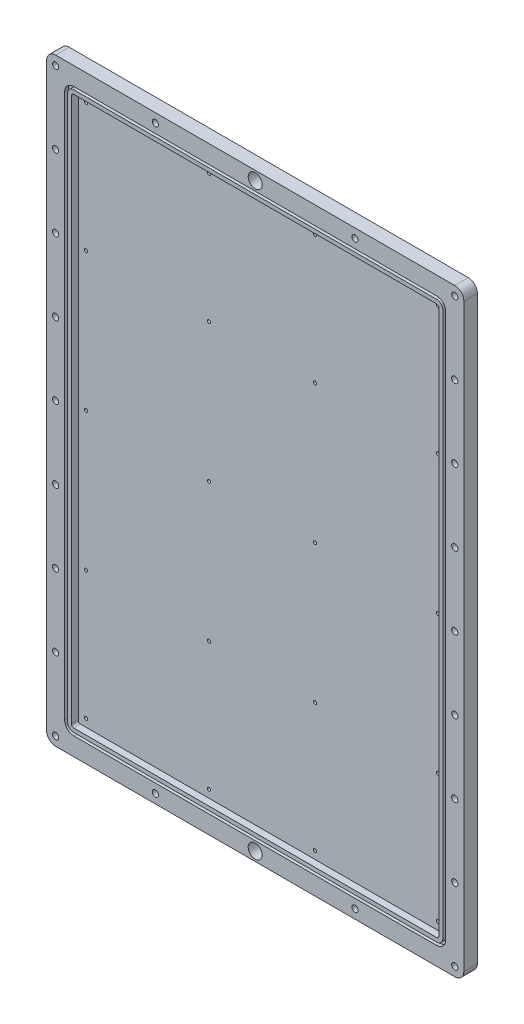
from build123d import *
from OCP.BRepFilletAPI import BRepFilletAPI_MakeChamfer

# Parameters (mm, degrees)
SKETCH1_W           = 292.0492
SKETCH1_H           = 419.0492
BOSS_EXTRUDE1_DEPTH = 9.525
SKETCH4_R           = 2.1844
CUT_EXTRUDE1_DEPTH  = 511.867588389
CUT_EXTRUDE2_DEPTH  = 2.54
LPATTERN3_COUNT     = 4
LPATTERN3_PITCH     = 69.85
LPATTERN4_COUNT     = 8
LPATTERN4_PITCH     = 50.8
CUT_EXTRUDE3_DEPTH  = 4.7625
SKETCH7_R           = 1.1303
CUT_EXTRUDE4_DEPTH  = 3.175
SKETCH8_R           = 4.9022
CUT_EXTRUDE5_DEPTH  = 511.867588389
FILLET1_R           = 6.35
CHAMFER1_SIZE       = 2.8448
CHAMFER1_SIZE2      = 2.472946912


with BuildPart() as part:
    # Sketch1 → Boss-Extrude1 (new body)
    with BuildSketch(Plane.XY):
        with Locations((146.0246, 209.5246)):
            Rectangle(SKETCH1_W, SKETCH1_H)
    extrude(amount=BOSS_EXTRUDE1_DEPTH)

    # Sketch4 → Cut-Extrude1 (cut, through all)
    with BuildSketch(Plane.XY.offset(9.525)):
        with Locations((6.3246, 6.3246)):
            Circle(SKETCH4_R)
        with Locations((6.3246, 412.7246)):
            Circle(SKETCH4_R)
        with Locations((285.7246, 412.7246)):
            Circle(SKETCH4_R)
        with Locations((285.7246, 6.3246)):
            Circle(SKETCH4_R)
    cut_extrude1 = extrude(amount=-CUT_EXTRUDE1_DEPTH, mode=Mode.SUBTRACT)

    # Sketch5 → Cut-Extrude2 (cut)
    with BuildSketch(Plane.XY.offset(9.525)):
        with BuildLine():
            Line((19.0246, 406.3746), (273.0246, 406.3746))
            ThreePointArc((273.0246, 406.3746), (277.514728061, 404.514728061), (279.3746, 400.0246))
            Line((279.3746, 400.0246), (279.3746, 19.0246))
            ThreePointArc((279.3746, 19.0246), (277.514728061, 14.534471939), (273.0246, 12.6746))
            Line((273.0246, 12.6746), (19.0246, 12.6746))
            ThreePointArc((19.0246, 12.6746), (14.534471939, 14.534471939), (12.6746, 19.0246))
            Line((12.6746, 19.0246), (12.6746, 400.0246))
            ThreePointArc((12.6746, 400.0246), (14.534471939, 404.514728061), (19.0246, 406.3746))
        make_face()
        with BuildLine():
            ThreePointArc((273.0246, 14.7066), (276.077887081, 15.971312919), (277.3426, 19.0246))
            Line((277.3426, 19.0246), (277.3426, 400.0246))
            ThreePointArc((277.3426, 400.0246), (276.077887081, 403.077887081), (273.0246, 404.3426))
            Line((273.0246, 404.3426), (19.0246, 404.3426))
            ThreePointArc((19.0246, 404.3426), (15.971312919, 403.077887081), (14.7066, 400.0246))
            Line((14.7066, 400.0246), (14.7066, 19.0246))
            ThreePointArc((14.7066, 19.0246), (15.971312919, 15.971312919), (19.0246, 14.7066))
            Line((19.0246, 14.7066), (273.0246, 14.7066))
        make_face(mode=Mode.SUBTRACT)
    extrude(amount=-CUT_EXTRUDE2_DEPTH, mode=Mode.SUBTRACT)

    # LPattern3: Cut-Extrude1 ×4
    with Locations(*[(i * LPATTERN3_PITCH, 0, 0) for i in range(1, LPATTERN3_COUNT)]):
        add(cut_extrude1, mode=Mode.SUBTRACT)

    # LPattern4: Cut-Extrude1 ×8
    with Locations(*[(0, -i * LPATTERN4_PITCH, 0) for i in range(1, LPATTERN4_COUNT)]):
        add(cut_extrude1, mode=Mode.SUBTRACT)

    # Sketch6 → Cut-Extrude3 (cut)
    with BuildSketch(Plane.XY.offset(9.525)):
        with BuildLine():
            Line((274.6121, 19.0246), (274.6121, 400.0246))
            ThreePointArc((274.6121, 400.0246), (274.147132015, 401.147132015), (273.0246, 401.6121))
            Line((273.0246, 401.6121), (19.0246, 401.6121))
            ThreePointArc((19.0246, 401.6121), (17.902067985, 401.147132015), (17.4371, 400.0246))
            Line((17.4371, 400.0246), (17.4371, 19.0246))
            ThreePointArc((17.4371, 19.0246), (17.902067985, 17.902067985), (19.0246, 17.4371))
            Line((19.0246, 17.4371), (273.0246, 17.4371))
            ThreePointArc((273.0246, 17.4371), (274.147132015, 17.902067985), (274.6121, 19.0246))
        make_face()
    extrude(amount=-CUT_EXTRUDE3_DEPTH, mode=Mode.SUBTRACT)

    # Sketch7 → Cut-Extrude4 (cut)
    with BuildSketch(Plane.XY.offset(4.7625)):
        with Locations((22.8346, 396.2146)):
            Circle(SKETCH7_R)
        with Locations((269.2146, 396.2146)):
            Circle(SKETCH7_R)
        with Locations((22.8346, 22.8346)):
            Circle(SKETCH7_R)
        with Locations((108.8898, 22.8346)):
            Circle(SKETCH7_R)
        with Locations((108.8898, 396.2146)):
            Circle(SKETCH7_R)
        with Locations((183.1594, 396.2146)):
            Circle(SKETCH7_R)
        with Locations((183.1594, 22.8346)):
            Circle(SKETCH7_R)
        with Locations((269.2146, 22.8346)):
            Circle(SKETCH7_R)
        with Locations((269.2146, 112.649)):
            Circle(SKETCH7_R)
        with Locations((108.8898, 112.649)):
            Circle(SKETCH7_R)
        with Locations((183.1594, 112.649)):
            Circle(SKETCH7_R)
        with Locations((22.8346, 112.649)):
            Circle(SKETCH7_R)
        with Locations((269.2146, 209.5246)):
            Circle(SKETCH7_R)
        with Locations((108.8898, 209.5246)):
            Circle(SKETCH7_R)
        with Locations((183.1594, 209.5246)):
            Circle(SKETCH7_R)
        with Locations((22.8346, 209.5246)):
            Circle(SKETCH7_R)
        with Locations((269.2146, 306.4002)):
            Circle(SKETCH7_R)
        with Locations((108.8898, 306.4002)):
            Circle(SKETCH7_R)
        with Locations((183.1594, 306.4002)):
            Circle(SKETCH7_R)
        with Locations((22.8346, 306.4002)):
            Circle(SKETCH7_R)
    extrude(amount=-CUT_EXTRUDE4_DEPTH, mode=Mode.SUBTRACT)

    # Sketch8 → Cut-Extrude5 (cut, through all)
    with BuildSketch(Plane.XY.offset(9.525)):
        with Locations((146.0246, 412.7246)):
            Circle(SKETCH8_R)
        with Locations((146.0246, 6.3246)):
            Circle(SKETCH8_R)
    extrude(amount=-CUT_EXTRUDE5_DEPTH, mode=Mode.SUBTRACT)

    # Fillet1
    fillet1_edges = [part.edges().sort_by_distance(p)[0] for p in [
        (0, 419.0492, 4.7625),
        (292.0492, 419.0492, 4.7625),
        (292.0492, 0, 4.7625),
        (0, 0, 4.7625),
    ]]
    fillet(fillet1_edges, radius=FILLET1_R)

    # Chamfer1: one chamfer whose edges measure the first distance from different faces: ONE call of the kernel's chamfer builder (chamfer() names one face for all edges)
    chamfer1_edges_1 = [part.edges().sort_by_distance(p)[0] for p in [
        (4.1402, 107.9246, 0),
    ]]
    chamfer1_side_1 = [part.faces().sort_by_distance(p)[0] for p in [
        (4.1402, 107.9246, 4.7625),
    ]]
    chamfer1_edges_2 = [part.edges().sort_by_distance(p)[0] for p in [
        (283.5402, 107.9246, 0),
    ]]
    chamfer1_side_2 = [part.faces().sort_by_distance(p)[0] for p in [
        (283.5402, 107.9246, 4.7625),
    ]]
    chamfer1_edges_3 = [part.edges().sort_by_distance(p)[0] for p in [
        (4.1402, 57.1246, 0),
    ]]
    chamfer1_side_3 = [part.faces().sort_by_distance(p)[0] for p in [
        (4.1402, 57.1246, 4.7625),
    ]]
    chamfer1_edges_4 = [part.edges().sort_by_distance(p)[0] for p in [
        (283.5402, 57.1246, 0),
    ]]
    chamfer1_side_4 = [part.faces().sort_by_distance(p)[0] for p in [
        (283.5402, 57.1246, 4.7625),
    ]]
    chamfer1_edges_5 = [part.edges().sort_by_distance(p)[0] for p in [
        (4.1402, 6.3246, 0),
    ]]
    chamfer1_side_5 = [part.faces().sort_by_distance(p)[0] for p in [
        (4.1402, 6.3246, 4.7625),
    ]]
    chamfer1_edges_6 = [part.edges().sort_by_distance(p)[0] for p in [
        (4.1402, 412.7246, 0),
    ]]
    chamfer1_side_6 = [part.faces().sort_by_distance(p)[0] for p in [
        (4.1402, 412.7246, 4.7625),
    ]]
    chamfer1_edges_7 = [part.edges().sort_by_distance(p)[0] for p in [
        (283.5402, 412.7246, 0),
    ]]
    chamfer1_side_7 = [part.faces().sort_by_distance(p)[0] for p in [
        (283.5402, 412.7246, 4.7625),
    ]]
    chamfer1_edges_8 = [part.edges().sort_by_distance(p)[0] for p in [
        (283.5402, 6.3246, 0),
    ]]
    chamfer1_side_8 = [part.faces().sort_by_distance(p)[0] for p in [
        (283.5402, 6.3246, 4.7625),
    ]]
    chamfer1_edges_9 = [part.edges().sort_by_distance(p)[0] for p in [
        (73.9902, 412.7246, 0),
    ]]
    chamfer1_side_9 = [part.faces().sort_by_distance(p)[0] for p in [
        (73.9902, 412.7246, 4.7625),
    ]]
    chamfer1_edges_10 = [part.edges().sort_by_distance(p)[0] for p in [
        (73.9902, 6.3246, 0),
    ]]
    chamfer1_side_10 = [part.faces().sort_by_distance(p)[0] for p in [
        (73.9902, 6.3246, 4.7625),
    ]]
    chamfer1_edges_11 = [part.edges().sort_by_distance(p)[0] for p in [
        (213.6902, 412.7246, 0),
    ]]
    chamfer1_side_11 = [part.faces().sort_by_distance(p)[0] for p in [
        (213.6902, 412.7246, 4.7625),
    ]]
    chamfer1_edges_12 = [part.edges().sort_by_distance(p)[0] for p in [
        (213.6902, 6.3246, 0),
    ]]
    chamfer1_side_12 = [part.faces().sort_by_distance(p)[0] for p in [
        (213.6902, 6.3246, 4.7625),
    ]]
    chamfer1_edges_13 = [part.edges().sort_by_distance(p)[0] for p in [
        (4.1402, 361.9246, 0),
    ]]
    chamfer1_side_13 = [part.faces().sort_by_distance(p)[0] for p in [
        (4.1402, 361.9246, 4.7625),
    ]]
    chamfer1_edges_14 = [part.edges().sort_by_distance(p)[0] for p in [
        (283.5402, 361.9246, 0),
    ]]
    chamfer1_side_14 = [part.faces().sort_by_distance(p)[0] for p in [
        (283.5402, 361.9246, 4.7625),
    ]]
    chamfer1_edges_15 = [part.edges().sort_by_distance(p)[0] for p in [
        (4.1402, 311.1246, 0),
    ]]
    chamfer1_side_15 = [part.faces().sort_by_distance(p)[0] for p in [
        (4.1402, 311.1246, 4.7625),
    ]]
    chamfer1_edges_16 = [part.edges().sort_by_distance(p)[0] for p in [
        (283.5402, 311.1246, 0),
    ]]
    chamfer1_side_16 = [part.faces().sort_by_distance(p)[0] for p in [
        (283.5402, 311.1246, 4.7625),
    ]]
    chamfer1_edges_17 = [part.edges().sort_by_distance(p)[0] for p in [
        (4.1402, 260.3246, 0),
    ]]
    chamfer1_side_17 = [part.faces().sort_by_distance(p)[0] for p in [
        (4.1402, 260.3246, 4.7625),
    ]]
    chamfer1_edges_18 = [part.edges().sort_by_distance(p)[0] for p in [
        (283.5402, 260.3246, 0),
    ]]
    chamfer1_side_18 = [part.faces().sort_by_distance(p)[0] for p in [
        (283.5402, 260.3246, 4.7625),
    ]]
    chamfer1_edges_19 = [part.edges().sort_by_distance(p)[0] for p in [
        (4.1402, 209.5246, 0),
    ]]
    chamfer1_side_19 = [part.faces().sort_by_distance(p)[0] for p in [
        (4.1402, 209.5246, 4.7625),
    ]]
    chamfer1_edges_20 = [part.edges().sort_by_distance(p)[0] for p in [
        (283.5402, 209.5246, 0),
    ]]
    chamfer1_side_20 = [part.faces().sort_by_distance(p)[0] for p in [
        (283.5402, 209.5246, 4.7625),
    ]]
    chamfer1_edges_21 = [part.edges().sort_by_distance(p)[0] for p in [
        (4.1402, 158.7246, 0),
    ]]
    chamfer1_side_21 = [part.faces().sort_by_distance(p)[0] for p in [
        (4.1402, 158.7246, 4.7625),
    ]]
    chamfer1_edges_22 = [part.edges().sort_by_distance(p)[0] for p in [
        (283.5402, 158.7246, 0),
    ]]
    chamfer1_side_22 = [part.faces().sort_by_distance(p)[0] for p in [
        (283.5402, 158.7246, 4.7625),
    ]]
    chamfer1 = BRepFilletAPI_MakeChamfer(part.part.solid().wrapped)
    for e in chamfer1_edges_1:
        chamfer1.Add(CHAMFER1_SIZE, CHAMFER1_SIZE2, e.wrapped, chamfer1_side_1[0].wrapped)  # the first distance lies on this face
    for e in chamfer1_edges_2:
        chamfer1.Add(CHAMFER1_SIZE, CHAMFER1_SIZE2, e.wrapped, chamfer1_side_2[0].wrapped)  # the first distance lies on this face
    for e in chamfer1_edges_3:
        chamfer1.Add(CHAMFER1_SIZE, CHAMFER1_SIZE2, e.wrapped, chamfer1_side_3[0].wrapped)  # the first distance lies on this face
    for e in chamfer1_edges_4:
        chamfer1.Add(CHAMFER1_SIZE, CHAMFER1_SIZE2, e.wrapped, chamfer1_side_4[0].wrapped)  # the first distance lies on this face
    for e in chamfer1_edges_5:
        chamfer1.Add(CHAMFER1_SIZE, CHAMFER1_SIZE2, e.wrapped, chamfer1_side_5[0].wrapped)  # the first distance lies on this face
    for e in chamfer1_edges_6:
        chamfer1.Add(CHAMFER1_SIZE, CHAMFER1_SIZE2, e.wrapped, chamfer1_side_6[0].wrapped)  # the first distance lies on this face
    for e in chamfer1_edges_7:
        chamfer1.Add(CHAMFER1_SIZE, CHAMFER1_SIZE2, e.wrapped, chamfer1_side_7[0].wrapped)  # the first distance lies on this face
    for e in chamfer1_edges_8:
        chamfer1.Add(CHAMFER1_SIZE, CHAMFER1_SIZE2, e.wrapped, chamfer1_side_8[0].wrapped)  # the first distance lies on this face
    for e in chamfer1_edges_9:
        chamfer1.Add(CHAMFER1_SIZE, CHAMFER1_SIZE2, e.wrapped, chamfer1_side_9[0].wrapped)  # the first distance lies on this face
    for e in chamfer1_edges_10:
        chamfer1.Add(CHAMFER1_SIZE, CHAMFER1_SIZE2, e.wrapped, chamfer1_side_10[0].wrapped)  # the first distance lies on this face
    for e in chamfer1_edges_11:
        chamfer1.Add(CHAMFER1_SIZE, CHAMFER1_SIZE2, e.wrapped, chamfer1_side_11[0].wrapped)  # the first distance lies on this face
    for e in chamfer1_edges_12:
        chamfer1.Add(CHAMFER1_SIZE, CHAMFER1_SIZE2, e.wrapped, chamfer1_side_12[0].wrapped)  # the first distance lies on this face
    for e in chamfer1_edges_13:
        chamfer1.Add(CHAMFER1_SIZE, CHAMFER1_SIZE2, e.wrapped, chamfer1_side_13[0].wrapped)  # the first distance lies on this face
    for e in chamfer1_edges_14:
        chamfer1.Add(CHAMFER1_SIZE, CHAMFER1_SIZE2, e.wrapped, chamfer1_side_14[0].wrapped)  # the first distance lies on this face
    for e in chamfer1_edges_15:
        chamfer1.Add(CHAMFER1_SIZE, CHAMFER1_SIZE2, e.wrapped, chamfer1_side_15[0].wrapped)  # the first distance lies on this face
    for e in chamfer1_edges_16:
        chamfer1.Add(CHAMFER1_SIZE, CHAMFER1_SIZE2, e.wrapped, chamfer1_side_16[0].wrapped)  # the first distance lies on this face
    for e in chamfer1_edges_17:
        chamfer1.Add(CHAMFER1_SIZE, CHAMFER1_SIZE2, e.wrapped, chamfer1_side_17[0].wrapped)  # the first distance lies on this face
    for e in chamfer1_edges_18:
        chamfer1.Add(CHAMFER1_SIZE, CHAMFER1_SIZE2, e.wrapped, chamfer1_side_18[0].wrapped)  # the first distance lies on this face
    for e in chamfer1_edges_19:
        chamfer1.Add(CHAMFER1_SIZE, CHAMFER1_SIZE2, e.wrapped, chamfer1_side_19[0].wrapped)  # the first distance lies on this face
    for e in chamfer1_edges_20:
        chamfer1.Add(CHAMFER1_SIZE, CHAMFER1_SIZE2, e.wrapped, chamfer1_side_20[0].wrapped)  # the first distance lies on this face
    for e in chamfer1_edges_21:
        chamfer1.Add(CHAMFER1_SIZE, CHAMFER1_SIZE2, e.wrapped, chamfer1_side_21[0].wrapped)  # the first distance lies on this face
    for e in chamfer1_edges_22:
        chamfer1.Add(CHAMFER1_SIZE, CHAMFER1_SIZE2, e.wrapped, chamfer1_side_22[0].wrapped)  # the first distance lies on this face
    add(Compound.cast(chamfer1.Shape()), mode=Mode.REPLACE)


solid = part.part
